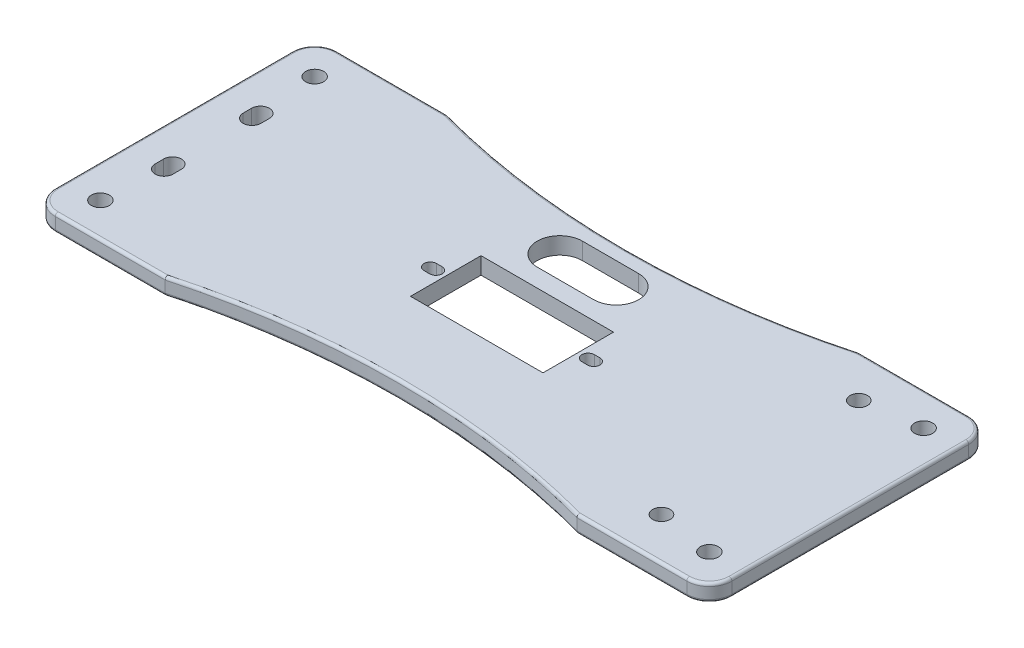
from build123d import *

# Parameters (mm, degrees)
SKETCH1_W           = 120
SKETCH1_H           = 50
SKETCH1_R           = 1.6
BOSS_EXTRUDE1_DEPTH = 3
SKETCH2_R           = 1.55
SKETCH2_W           = 23.5
SKETCH2_H           = 12.5
CUT_EXTRUDE1_DEPTH  = 10
CUT_EXTRUDE2_DEPTH  = 10
FILLET1_R           = 4
FILLET2_R           = 0.5


with BuildPart() as part:
    # Sketch1 → Boss-Extrude1 (new body)
    with BuildSketch(Plane(origin=(0, 0, 0), x_dir=(1, 0, 0), z_dir=(0, 1, 0))):
        Rectangle(SKETCH1_W, SKETCH1_H)
        with Locations(Location((-54, 19, 0), (0, 0, 270))):
            Circle(SKETCH1_R, mode=Mode.SUBTRACT)
        with Locations(Location((54, 19, 0), (0, 0, 270))):
            Circle(SKETCH1_R, mode=Mode.SUBTRACT)
        with Locations(Location((54, -19, 0), (0, 0, 270))):
            Circle(SKETCH1_R, mode=Mode.SUBTRACT)
        with Locations(Location((-54, -19, 0), (0, 0, 270))):
            Circle(SKETCH1_R, mode=Mode.SUBTRACT)
    extrude(amount=BOSS_EXTRUDE1_DEPTH)

    # Sketch2 → Cut-Extrude1 (cut)
    with BuildSketch(Plane(origin=(0, 3, 0), x_dir=(1, 0, 0), z_dir=(0, 1, 0))):
        with Locations(Location((44, 17.5, 0), (0, 0, 270))):
            Circle(SKETCH2_R)
        with Locations(Location((44, -17.5, 0), (0, 0, 270))):
            Circle(SKETCH2_R)
        with BuildLine():
            Line((-54.73176855, 7.05), (-54.73176855, 8.55))
            ThreePointArc((-54.73176855, 8.55), (-53.15676855, 10.125), (-51.58176855, 8.55))
            Line((-51.58176855, 8.55), (-51.58176855, 7.05))
            ThreePointArc((-51.58176855, 7.05), (-53.15676855, 5.475), (-54.73176855, 7.05))
        make_face()
        with BuildLine():
            Line((-51.58176855, -7.05), (-51.58176855, -8.55))
            ThreePointArc((-51.58176855, -8.55), (-53.15676855, -10.125), (-54.73176855, -8.55))
            Line((-54.73176855, -8.55), (-54.73176855, -7.05))
            ThreePointArc((-54.73176855, -7.05), (-53.15676855, -5.475), (-51.58176855, -7.05))
        make_face()
        Rectangle(SKETCH2_W, SKETCH2_H)
        with BuildLine():
            Line((-5, 17.476998697), (5, 17.476998697))
            ThreePointArc((5, 17.476998697), (9, 13.476998697), (5, 9.476998697))
            Line((5, 9.476998697), (-5, 9.476998697))
            ThreePointArc((-5, 9.476998697), (-9, 13.476998697), (-5, 17.476998697))
        make_face()
        with BuildLine():
            Line((-14.5, 1.1), (-13.5, 1.1))
            ThreePointArc((-13.5, 1.1), (-12.4, 0), (-13.5, -1.1))
            Line((-13.5, -1.1), (-14.5, -1.1))
            ThreePointArc((-14.5, -1.1), (-15.6, 0), (-14.5, 1.1))
        make_face()
        with BuildLine():
            Line((13.5, 1.1), (14.5, 1.1))
            ThreePointArc((14.5, 1.1), (15.6, 0), (14.5, -1.1))
            Line((14.5, -1.1), (13.5, -1.1))
            ThreePointArc((13.5, -1.1), (12.4, 0), (13.5, 1.1))
        make_face()
    extrude(amount=-CUT_EXTRUDE1_DEPTH, mode=Mode.SUBTRACT)

    # Sketch4 → Cut-Extrude2 (cut)
    with BuildSketch(Plane(origin=(0, 3, 0), x_dir=(1, 0, 0), z_dir=(0, 1, 0))):
        with BuildLine():
            Line((-36.5, -25), (36.5, -25))
            ThreePointArc((36.5, -25), (0, -20.158240592), (-36.5, -25))
        make_face()
        with BuildLine():
            Line((-36.5, 25), (36.5, 25))
            ThreePointArc((36.5, 25), (0, 20.158240592), (-36.5, 25))
        make_face()
    extrude(amount=-CUT_EXTRUDE2_DEPTH, mode=Mode.SUBTRACT)

    # Fillet1
    fillet1_edges = [part.edges().sort_by_distance(p)[0] for p in [
        (60, 1.5, 25),
        (-60, 1.5, 25),
        (-60, 1.5, -25),
        (60, 1.5, -25),
    ]]
    fillet(fillet1_edges, radius=FILLET1_R)

    # Fillet2
    fillet2_edges = [part.edges().sort_by_distance(p)[0] for p in [
        (46.25, 0, 25),
        (46.25, 3, 25),
        (-46.25, 0, -25),
        (-46.25, 3, -25),
        (-36.5, 1.5, -25),
        (36.5, 1.5, -25),
        (0, 0, 20.158240592),
        (0, 3, 20.158240592),
        (0, 0, -20.158240592),
        (0, 3, -20.158240592),
        (-46.25, 0, 25),
        (-46.25, 3, 25),
        (-60, 0, 0),
        (46.25, 0, -25),
        (60, 0, 0),
        (58.828427125, 0, -23.828427125),
        (-58.828427125, 0, -23.828427125),
        (58.828427125, 0, 23.828427125),
        (-58.828427125, 0, 23.828427125),
        (-60, 3, 0),
        (60, 3, 0),
        (46.25, 3, -25),
        (58.828427125, 3, -23.828427125),
        (-58.828427125, 3, -23.828427125),
        (58.828427125, 3, 23.828427125),
        (-58.828427125, 3, 23.828427125),
    ]]
    fillet(fillet2_edges, radius=FILLET2_R)


solid = part.part
